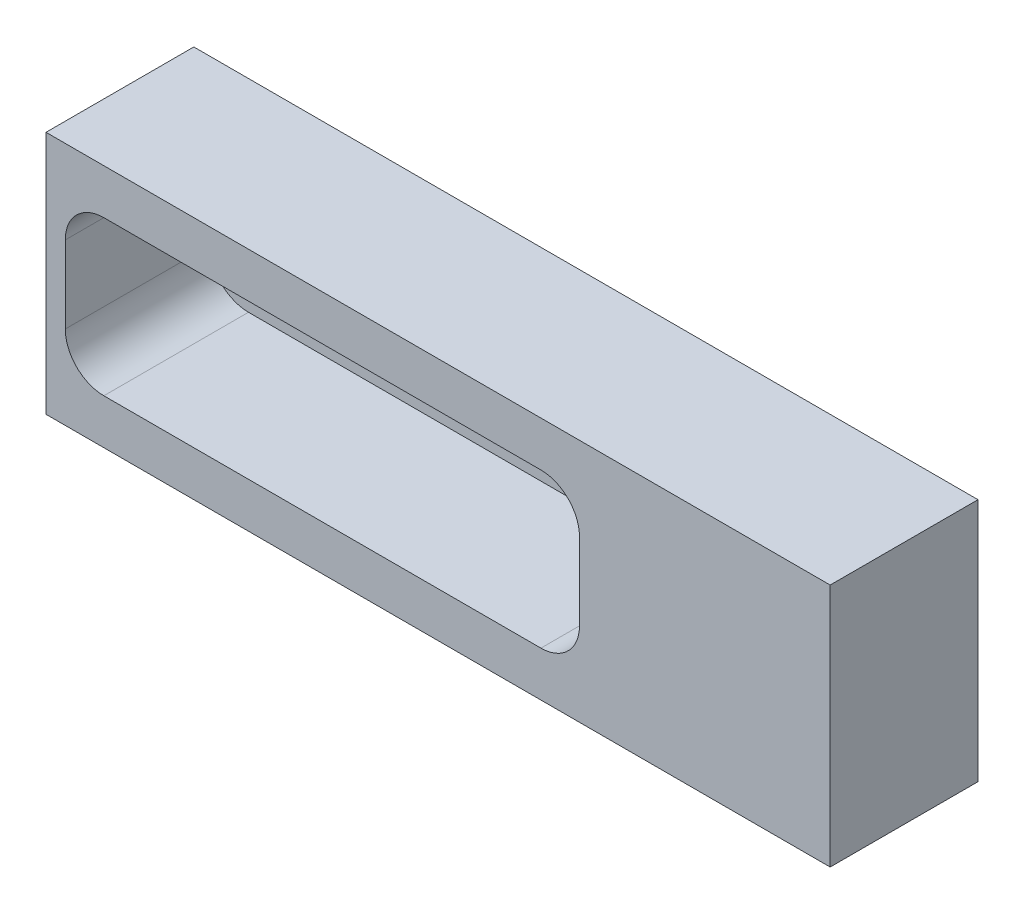
from build123d import *

# Parameters (mm, degrees)
SKETCH1_W           = 25
SKETCH1_H           = 38
BOSS_EXTRUDE1_DEPTH = 122
SKETCH2_W           = 80
SKETCH2_H           = 24
CUT_EXTRUDE1_DEPTH  = 22.5
FILLET1_R           = 6
FILLET2_R           = 6
FILLET3_R           = 6
FILLET4_R           = 6
SKETCH3_R           = 9.2
CUT_EXTRUDE2_DEPTH  = 126.503984001
CHAMFER2_SIZE       = 2


with BuildPart() as part:
    # Sketch1 → Boss-Extrude1 (new body)
    with BuildSketch(Plane(origin=(0, 0, 0), x_dir=(0, 0, -1), z_dir=(1, 0, 0))):
        Rectangle(SKETCH1_W, SKETCH1_H)
    extrude(amount=BOSS_EXTRUDE1_DEPTH)

    # Sketch2 → Cut-Extrude1 (cut)
    with BuildSketch(Plane.XY.offset(12.5)):
        with Locations((43, 0)):
            Rectangle(SKETCH2_W, SKETCH2_H)
    extrude(amount=-CUT_EXTRUDE1_DEPTH, mode=Mode.SUBTRACT)

    # Fillet1
    fillet1_edges = [part.edges().sort_by_distance(p)[0] for p in [
        (3, 12, 1.25),
    ]]
    fillet(fillet1_edges, radius=FILLET1_R)

    # Fillet2
    fillet2_edges = [part.edges().sort_by_distance(p)[0] for p in [
        (3, -12, 1.25),
    ]]
    fillet(fillet2_edges, radius=FILLET2_R)

    # Fillet3
    fillet3_edges = [part.edges().sort_by_distance(p)[0] for p in [
        (83, -12, 1.25),
    ]]
    fillet(fillet3_edges, radius=FILLET3_R)

    # Fillet4
    fillet4_edges = [part.edges().sort_by_distance(p)[0] for p in [
        (83, 12, 1.25),
    ]]
    fillet(fillet4_edges, radius=FILLET4_R)

    # Sketch3 → Cut-Extrude2 (cut, through all)
    with BuildSketch(Plane.XY.offset(-10)):
        with Locations((43, 0)):
            Circle(SKETCH3_R)
    extrude(amount=-CUT_EXTRUDE2_DEPTH, mode=Mode.SUBTRACT)

    # Chamfer2
    chamfer2_edges = [part.edges().sort_by_distance(p)[0] for p in [
        (122, 0, -12.5),
        (0, 0, -12.5),
        (61, -19, -12.5),
        (61, 19, -12.5),
    ]]
    chamfer(chamfer2_edges, length=CHAMFER2_SIZE)


solid = part.part
